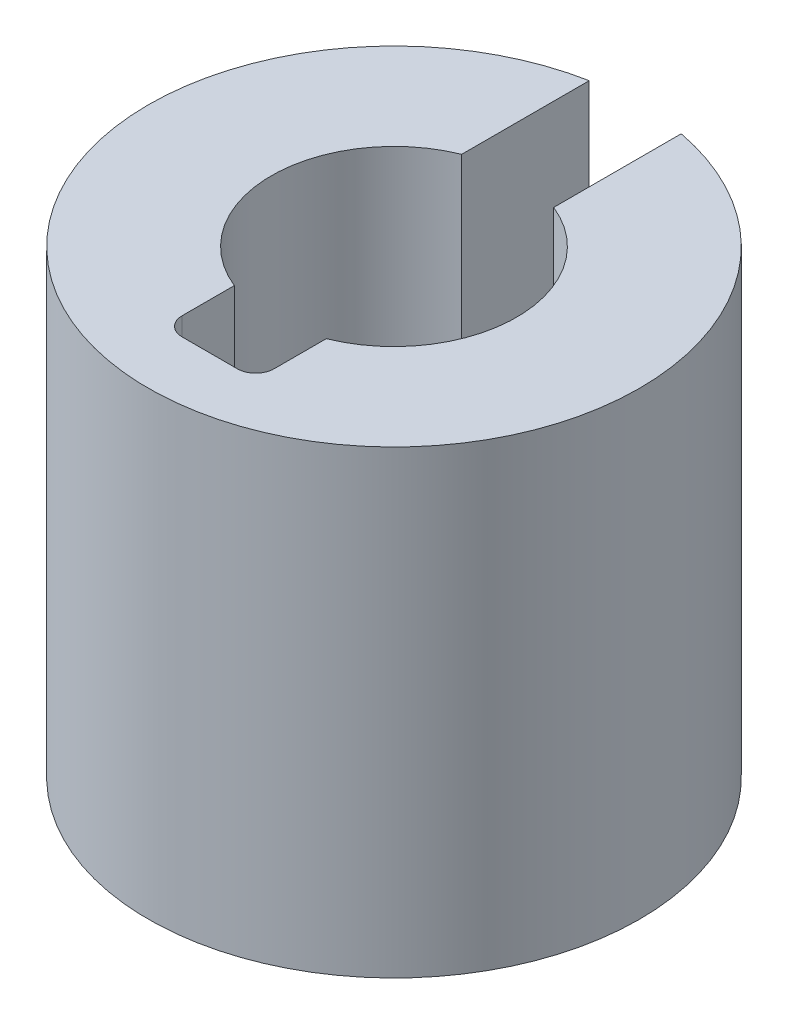
from build123d import *

# Parameters (mm, degrees)
BOSS_EXTRUDE1_DEPTH = 7.5


with BuildPart() as part:
    # Sketch1 → Boss-Extrude1 (new body)
    with BuildSketch(Plane.XZ.offset(3.75)):
        with BuildLine():
            Line((0.75, -1.854049622), (0.75, -3.934148574))
            ThreePointArc((0.75, -3.934148574), (0, 4.005), (-0.75, -3.934148574))
            Line((-0.75, -3.934148574), (-0.75, -1.854049622))
            ThreePointArc((-0.75, -1.854049622), (-2, 0), (-0.75, 1.854049622))
            Line((-0.75, 1.854049622), (-0.75, 2.705))
            ThreePointArc((-0.75, 2.705), (-0.662132034, 2.917132034), (-0.45, 3.005))
            Line((-0.45, 3.005), (0.45, 3.005))
            ThreePointArc((0.45, 3.005), (0.662132034, 2.917132034), (0.75, 2.705))
            Line((0.75, 2.705), (0.75, 1.854049622))
            ThreePointArc((0.75, 1.854049622), (2, 0), (0.75, -1.854049622))
        make_face()
    extrude(amount=-BOSS_EXTRUDE1_DEPTH)


solid = part.part
